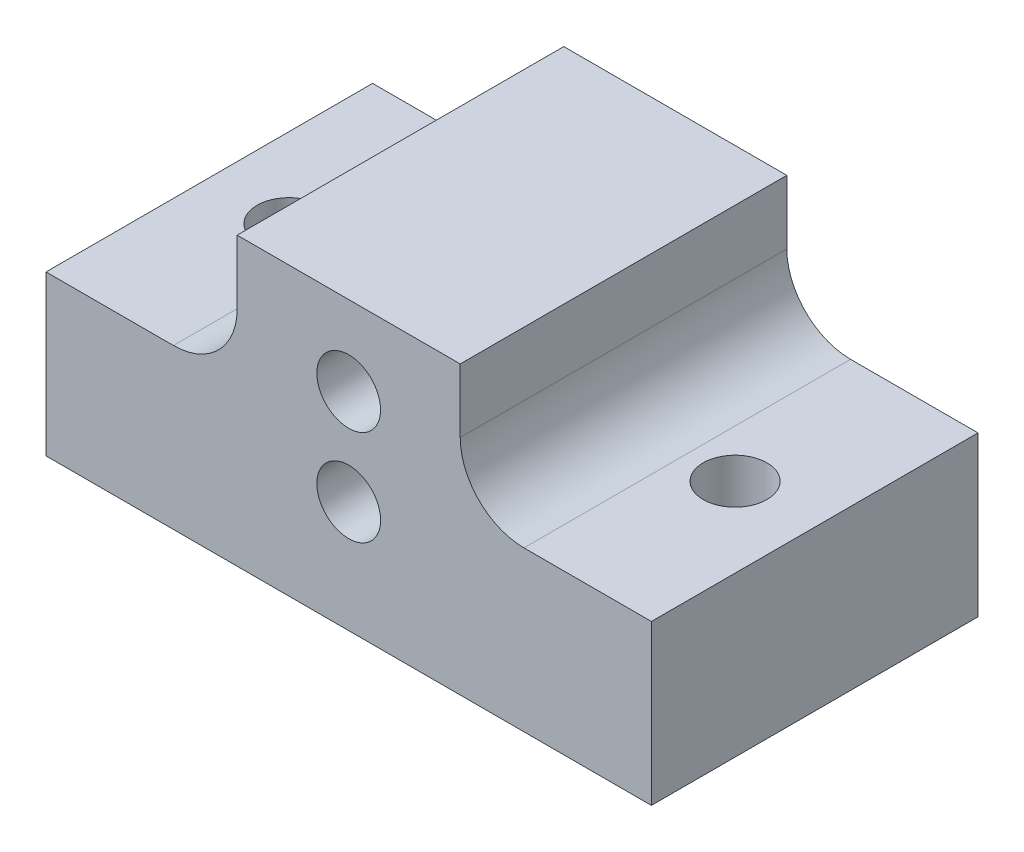
from build123d import *

# Parameters (mm, degrees)
SKETCH_1_R          = 2
EXTRUDE_1_DEPTH     = 20.5
SKETCH_2_R          = 2
CUT_EXTRUDE_1_DEPTH = 20.5
MOVE_BODY_1_ANGLE   = 90


with BuildPart() as part:
    # 草图1 → 凸台-拉伸1 (new body)
    with BuildSketch(Plane(origin=(0, 0, 0), x_dir=(0, 0, -1), z_dir=(1, 0, 0))):
        with BuildLine():
            Line((-7, 18), (7, 18))
            Line((7, 18), (7, 14))
            ThreePointArc((7, 14), (8.171572875, 11.171572875), (11, 10))
            Line((11, 10), (19, 10))
            Line((19, 10), (19, 0))
            Line((19, 0), (7, 0))
            Line((7, 0), (-7, 0))
            Line((-7, 0), (-19, 0))
            Line((-19, 0), (-19, 10))
            Line((-19, 10), (-11, 10))
            ThreePointArc((-11, 10), (-8.171572875, 11.171572875), (-7, 14))
            Line((-7, 14), (-7, 18))
        make_face()
        with Locations((0, 13)):
            Circle(SKETCH_1_R, mode=Mode.SUBTRACT)
        with Locations((0, 7)):
            Circle(SKETCH_1_R, mode=Mode.SUBTRACT)
    extrude(amount=EXTRUDE_1_DEPTH)

    # 草图2 → 切除-拉伸1 (cut)
    with BuildSketch(Plane(origin=(0, 10, 0), x_dir=(1, 0, 0), z_dir=(0, 1, 0))):
        with Locations(Location((10.25, 14, 0), (0, 0, 270))):
            Circle(SKETCH_2_R)
        with Locations(Location((10.25, -14, 0), (0, 0, 270))):
            Circle(SKETCH_2_R)
    extrude(amount=-CUT_EXTRUDE_1_DEPTH, mode=Mode.SUBTRACT)


with BuildPart() as part_1:
    # Move Body 1: moved
    add(part.part.rotate(Axis((10.25, 0, 0), (0, -1, 0)), MOVE_BODY_1_ANGLE))


solid = part_1.part
